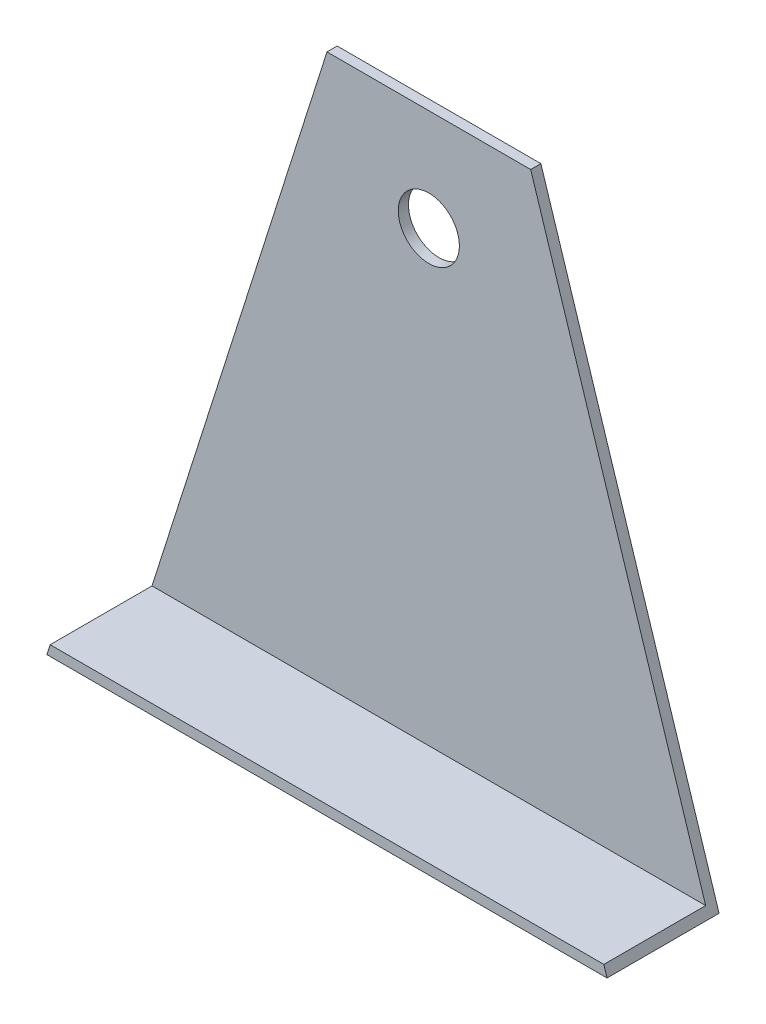
from build123d import *

# Parameters (mm, degrees)
BOSS_EXTRUDE1_DEPTH = 2
SKETCH2_R           = 6
CUT_EXTRUDE1_DEPTH  = 124
BOSS_EXTRUDE2_DEPTH = 20


with BuildPart() as part:
    # Sketch1 → Boss-Extrude1 (new body)
    with BuildSketch(Plane.XY):
        Polygon((-55, 0), (55, 0), (20, 110), (-20, 110), align=None)
    extrude(amount=BOSS_EXTRUDE1_DEPTH)

    # Sketch2 → Cut-Extrude1 (cut, through all)
    with BuildSketch(Plane.XY.offset(2)):
        with Locations((0, 90)):
            Circle(SKETCH2_R)
    extrude(amount=-CUT_EXTRUDE1_DEPTH, mode=Mode.SUBTRACT)

    # Sketch4 → Boss-Extrude2 (add)
    with BuildSketch(Plane.XY.offset(2)):
        Polygon((-55, 0), (-54.363636364, 2), (54.363636364, 2), (55, 0), align=None)
    extrude(amount=BOSS_EXTRUDE2_DEPTH)


solid = part.part
